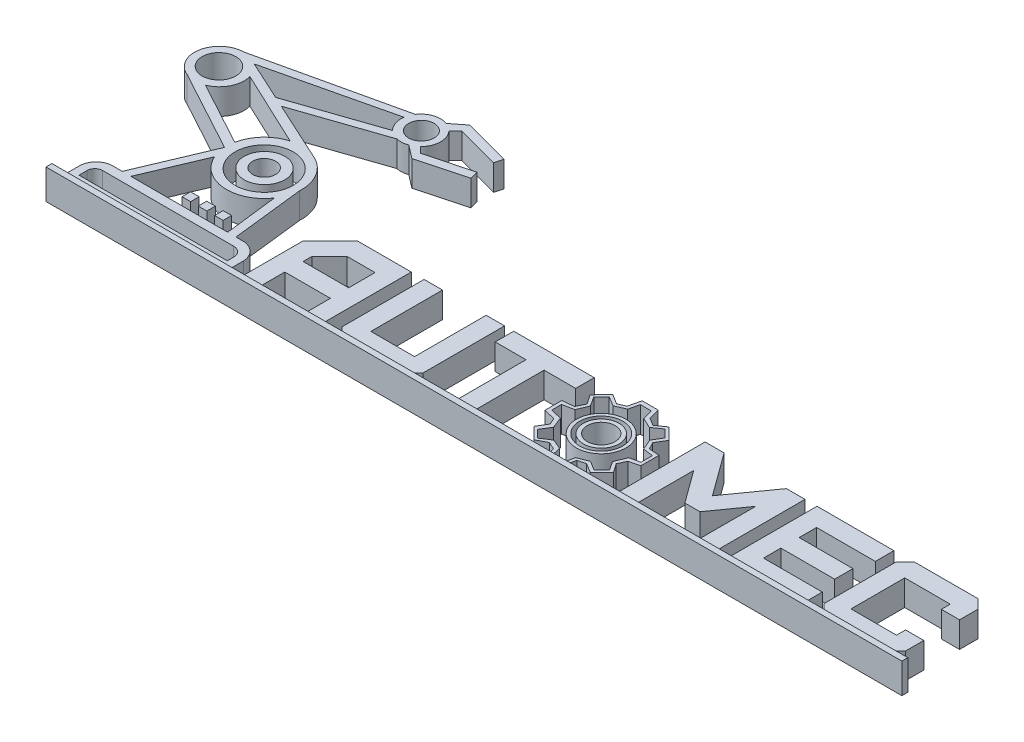
from build123d import *

# Parameters (mm, degrees)
SKETCH1_W              = 10.037720294
SKETCH1_H              = 9.89427134
BOSS_EXTRUDE3_DEPTH    = 30
SKETCH1_W_2            = 9.837608832
BOSS_EXTRUDE3_2_DEPTH  = 30
SKETCH1_W_3            = 10.004172051
BOSS_EXTRUDE3_3_DEPTH  = 30
SKETCH1_R              = 14.841134558
SKETCH1_R_2            = 19.638478863
SKETCH1_R_3            = 33.945181935
BOSS_EXTRUDE3_4_DEPTH  = 30
BOSS_EXTRUDE3_5_DEPTH  = 30
BOSS_EXTRUDE3_6_DEPTH  = 30
BOSS_EXTRUDE3_7_DEPTH  = 30
BOSS_EXTRUDE3_8_DEPTH  = 30
BOSS_EXTRUDE3_9_DEPTH  = 30
BOSS_EXTRUDE3_10_DEPTH = 30
BOSS_EXTRUDE3_11_DEPTH = 30
SKETCH1_R_4            = 23.705875318
SKETCH1_R_5            = 13.441561648
BOSS_EXTRUDE3_12_DEPTH = 30
SKETCH1_R_6            = 28.936539224
SKETCH1_R_7            = 25.172875838
BOSS_EXTRUDE3_13_DEPTH = 30
SKETCH1_R_8            = 20.860639354
SKETCH1_R_9            = 16.254652286
BOSS_EXTRUDE3_14_DEPTH = 30
BOSS_EXTRUDE4_DEPTH    = 35


with BuildPart() as part:
    # Sketch1 → Boss-Extrude3 (new body)
    with BuildSketch(Plane(origin=(0, 0, 0), x_dir=(1, 0, 0), z_dir=(0, 1, 0))):
        with Locations((114.128971817, 54.083331286)):
            Rectangle(SKETCH1_W, SKETCH1_H)
    extrude(amount=BOSS_EXTRUDE3_DEPTH)


with BuildPart() as body_2:
    # Sketch1 → Boss-Extrude3 2 (new body)
    with BuildSketch(Plane(origin=(0, 0, 0), x_dir=(1, 0, 0), z_dir=(0, 1, 0))):
        with Locations((133.169168206, 54.083331286)):
            Rectangle(SKETCH1_W_2, SKETCH1_H)
    extrude(amount=BOSS_EXTRUDE3_2_DEPTH)


with BuildPart() as body_3:
    # Sketch1 → Boss-Extrude3 3 (new body)
    with BuildSketch(Plane(origin=(0, 0, 0), x_dir=(1, 0, 0), z_dir=(0, 1, 0))):
        with Locations((95.198962506, 54.083331286)):
            Rectangle(SKETCH1_W_3, SKETCH1_H)
    extrude(amount=BOSS_EXTRUDE3_3_DEPTH)


with BuildPart() as body_4:
    # Sketch1 → Boss-Extrude3 4 (new body)
    with BuildSketch(Plane(origin=(0, 0, 0), x_dir=(1, 0, 0), z_dir=(0, 1, 0))):
        with BuildLine():
            Line((143.142771274, 268.551222923), (-20.066683919, 231.448561929))
            ThreePointArc((-20.066683919, 231.448561929), (-48.08274217, 207.697002969), (-30.2767921, 175.572491843))
            Line((-30.2767921, 175.572491843), (65.13223045, 123.762206868))
            Line((65.13223045, 123.762206868), (29.665610075, 39.838888731))
            Line((29.665610075, 39.838888731), (17.427719175, 39.838888731))
            ThreePointArc((17.427719175, 39.838888731), (4.37706487, 33.661602398), (-0.92807644, 20.232755838))
            Line((-0.92807644, 20.232755838), (-0.92807644, 6.699341433))
            ThreePointArc((-0.92807644, 6.699341433), (1.439006355, 3.093293076), (5.519838836, 1.695626459))
            Line((5.519838836, 1.695626459), (187.056420311, 1.695626459))
            ThreePointArc((187.056420311, 1.695626459), (189.890342969, 3.516284124), (190.99218603, 6.699341433))
            Line((190.99218603, 6.699341433), (190.99218603, 20.232755838))
            ThreePointArc((190.99218603, 20.232755838), (184.584997904, 34.156147144), (170.350556109, 39.838888731))
            Line((170.350556109, 39.838888731), (162.419916837, 39.838888731))
            Line((162.419916837, 39.838888731), (152.794511162, 123.762206868))
            ThreePointArc((152.794511162, 123.762206868), (145.984902768, 149.800684723), (125.259763461, 166.97163974))
            Line((125.259763461, 166.97163974), (56.575915473, 198.553079106))
            Line((56.575915473, 198.553079106), (157.148813199, 232.909520835))
            ThreePointArc((157.148813199, 232.909520835), (163.806970263, 232.345523476), (170.350556109, 233.698532264))
            Line((170.350556109, 233.698532264), (185.669513374, 221.850702315))
            Line((185.669513374, 221.850702315), (240.175788961, 236.31824449))
            Line((240.175788961, 236.31824449), (237.60073395, 246.019730503))
            Line((237.60073395, 246.019730503), (185.669513374, 232.235682413))
            Line((185.669513374, 232.235682413), (178.835688766, 239.089620535))
            ThreePointArc((178.835688766, 239.089620535), (185.666823394, 255.200048889), (179.328917733, 271.510819989))
            Line((179.328917733, 271.510819989), (187.056420311, 278.803304387))
            Line((187.056420311, 278.803304387), (237.60073395, 265.195725475))
            Line((237.60073395, 265.195725475), (240.175788961, 274.76057084))
            Line((240.175788961, 274.76057084), (185.669513374, 289.434792188))
            Line((185.669513374, 289.434792188), (170.350556109, 277.408883435))
            ThreePointArc((170.350556109, 277.408883435), (155.222671622, 277.661249559), (143.142771274, 268.551222923))
        make_face()
        with BuildLine():
            Line((-1.969110638, 225.472598709), (139.423502901, 258.97550346))
            ThreePointArc((139.423502901, 258.97550346), (140.395436733, 248.10615689), (146.219590259, 238.877582463))
            Line((146.219590259, 238.877582463), (44.470389253, 204.119306881))
            Line((44.470389253, 204.119306881), (-1.969110638, 225.472598709))
        make_face(mode=Mode.SUBTRACT)
        with Locations((163.173974101, 255.540121232)):
            Circle(SKETCH1_R, mode=Mode.SUBTRACT)
        with Locations((-20.066683919, 202.485175867)):
            Circle(SKETCH1_R_2, mode=Mode.SUBTRACT)
        with BuildLine():
            Line((8.324402462, 210.195837049), (97.055580754, 168.462639817))
            ThreePointArc((97.055580754, 168.462639817), (76.78336776, 156.068842703), (65.938427209, 134.92750663))
            Line((65.938427209, 134.92750663), (-8.909613341, 175.572491843))
            ThreePointArc((-8.909613341, 175.572491843), (6.333753594, 189.585847209), (8.324402462, 210.195837049))
        make_face(mode=Mode.SUBTRACT)
        with Locations((109.737807996, 125.434673325)):
            Circle(SKETCH1_R_3, mode=Mode.SUBTRACT)
        with BuildLine():
            ThreePointArc((68.82897061, 108.421864432), (105.123555566, 82.477977197), (145.3839321, 101.699950647))
            Line((145.3839321, 101.699950647), (152.794511162, 39.838888731))
            Line((152.794511162, 39.838888731), (39.756094219, 39.838888731))
            Line((39.756094219, 39.838888731), (68.82897061, 108.421864432))
        make_face(mode=Mode.SUBTRACT)
        with BuildLine():
            Line((17.34286461, 29.251217986), (170.350556109, 29.251217986))
            ThreePointArc((170.350556109, 29.251217986), (177.471060726, 26.709270346), (181.372066191, 20.232755838))
            Line((181.372066191, 20.232755838), (181.372066191, 10.7136894))
            Line((181.372066191, 10.7136894), (8.324402462, 10.7136894))
            Line((8.324402462, 10.7136894), (8.324402462, 20.232755838))
            ThreePointArc((8.324402462, 20.232755838), (10.96584887, 26.609771579), (17.34286461, 29.251217986))
        make_face(mode=Mode.SUBTRACT)
    extrude(amount=BOSS_EXTRUDE3_4_DEPTH)



with BuildPart() as body_5:
    # Sketch1 → Boss-Extrude3 5 (new body)
    with BuildSketch(Plane(origin=(0, 0, 0), x_dir=(1, 0, 0), z_dir=(0, 1, 0))):
        Polygon((205.524825841, 74.70012702), (205.524825841, 1.695626459), (226.323997377, 1.695626459), (226.323997377, 32.972523229), (279.551984747, 32.972523229), (279.551984747, 1.695626459), (300.127509276, 1.695626459), (300.127509276, 106.776035129), (237.60073395, 106.776035129), align=None)
        Polygon((279.551984747, 54.235830794), (226.323997377, 54.235830794), (226.323997377, 64.730398046), (246.6758749, 85.08227557), (279.551984747, 85.08227557), align=None, mode=Mode.SUBTRACT)
    extrude(amount=BOSS_EXTRUDE3_5_DEPTH)


with BuildPart() as body_6:
    # Sketch1 → Boss-Extrude3 6 (new body)
    with BuildSketch(Plane(origin=(0, 0, 0), x_dir=(1, 0, 0), z_dir=(0, 1, 0))):
        Polygon((886.728702325, 1.695626459), (961.16194012, 1.695626459), (971.701040984, 12.234727322), (971.701040984, 33.464350851), (950.471417455, 33.464350851), (950.471417455, 22.849539087), (897.34351409, 22.849539087), (897.34351409, 85.574103193), (950.471417455, 85.574103193), (950.471417455, 75.191954642), (971.701040984, 75.191954642), (971.701040984, 96.728761888), (961.086229219, 107.343573652), (886.728702325, 107.267862751), (876.189601462, 96.728761888), (876.189601462, 12.234727322), align=None)
    extrude(amount=BOSS_EXTRUDE3_6_DEPTH)


with BuildPart() as body_7:
    # Sketch1 → Boss-Extrude3 7 (new body)
    with BuildSketch(Plane(origin=(0, 0, 0), x_dir=(1, 0, 0), z_dir=(0, 1, 0))):
        Polygon((315.111858662, 10.7136894), (324.129921603, 1.695626459), (398.979485821, 1.695626459), (409.026759062, 11.7428997), (409.026759062, 106.776035129), (387.573488527, 106.776035129), (387.573488527, 23.148896994), (336.565129197, 23.148896994), (336.565129197, 106.776035129), (315.111858662, 106.776035129), align=None)
    extrude(amount=BOSS_EXTRUDE3_7_DEPTH)


with BuildPart() as body_8:
    # Sketch1 → Boss-Extrude3 8 (new body)
    with BuildSketch(Plane(origin=(0, 0, 0), x_dir=(1, 0, 0), z_dir=(0, 1, 0))):
        Polygon((773.755843894, 1.695626459), (863.525068241, 1.695626459), (863.525068241, 23.148896994), (794.917323579, 23.148896994), (794.917323579, 43.388951015), (857.73350538, 43.388951015), (857.73350538, 64.730398046), (794.917323579, 64.730398046), (794.917323579, 85.08227557), (863.525068241, 85.08227557), (863.525068241, 106.776035129), (773.755843894, 106.776035129), align=None)
    extrude(amount=BOSS_EXTRUDE3_8_DEPTH)


with BuildPart() as body_9:
    # Sketch1 → Boss-Extrude3 9 (new body)
    with BuildSketch(Plane(origin=(0, 0, 0), x_dir=(1, 0, 0), z_dir=(0, 1, 0))):
        Polygon((455.785825283, 85.08227557), (455.785825283, 1.695626459), (476.808643824, 1.695626459), (476.808643824, 85.08227557), (513.710399774, 85.08227557), (513.710399774, 106.776035129), (419.778657356, 106.776035129), (419.778657356, 85.08227557), align=None)
    extrude(amount=BOSS_EXTRUDE3_9_DEPTH)


with BuildPart() as body_10:
    # Sketch1 → Boss-Extrude3 10 (new body)
    with BuildSketch(Plane(origin=(0, 0, 0), x_dir=(1, 0, 0), z_dir=(0, 1, 0))):
        Polygon((738.028346548, 1.695626459), (759.722106106, 1.695626459), (759.722106106, 106.776035128), (738.028346548, 106.776035128), (702.133002124, 56.344559491), (665.566716683, 106.475757274), (643.425663113, 106.475757274), (643.425663113, 1.695626459), (665.566716683, 1.695626459), (665.566716683, 70.992514208), (693.298945397, 32.972523229), (710.967058851, 32.972523229), (738.028346548, 70.992514208), align=None)
    extrude(amount=BOSS_EXTRUDE3_10_DEPTH)


with BuildPart() as body_11:
    # Sketch1 → Boss-Extrude3 11 (new body)
    with BuildSketch(Plane(origin=(0, 0, 0), x_dir=(1, 0, 0), z_dir=(0, 1, 0))):
        Polygon((561.811156285, 11.022132391), (564.206833782, 1.695626459), (584.548916634, 1.695626459), (587.139669167, 13.048376699), (596.077110393, 15.344116066), (607.08101677, 8.714733796), (620.584288241, 22.351755897), (613.542887133, 32.620988551), (617.886588615, 41.869512454), (629.982213547, 44.976486993), (629.982213547, 66.07345155), (617.886588615, 66.967470506), (613.542887133, 75.129982665), (620.710099352, 87.026616321), (607.08101677, 100.448493701), (596.077110393, 92.903341968), (587.139669167, 98.287767497), (583.786023452, 111.343697056), (565.065547238, 111.343697056), (561.811156285, 97.082864651), (553.182677099, 93.315612167), (541.853221859, 100.448493701), (528.56298499, 87.026616321), (536.144263058, 75.970023025), (531.496196769, 66.07345155), (517.881347226, 64.708779488), (517.881347226, 44.976486993), (531.496196769, 41.869512454), (534.830790982, 34.231989649), (527.62577602, 22.272608391), (541.287700266, 8.744679012), (553.182677099, 15.074621006), align=None)
        Polygon((540.060260784, 75.991641583), (532.888416484, 87.04823488), (541.853221859, 96.101837134), (553.182677099, 89.276325618), (565.065547238, 94.464467245), (567.806581737, 106.475757274), (580.70071182, 106.475757274), (583.786023452, 94.464467245), (596.077110393, 88.691782532), (607.08101677, 96.236934265), (615.924941998, 87.04823488), (609.263818115, 75.991641583), (614.808785716, 63.291500634), (626.508975948, 61.946779828), (626.508975948, 48.502177727), (614.808785716, 46.108956998), (609.263818115, 32.642607109), (615.924941998, 22.373374455), (607.08101677, 13.224486288), (596.077110393, 19.989186093), (583.764503353, 15.08767265), (581.488576126, 5.202505812), (567.089265505, 5.202505812), (565.065547238, 15.096239565), (553.182677099, 19.989186093), (541.853221859, 12.640350262), (532.888416484, 21.306328792), (540.060260784, 32.972523229), (534.830790982, 46.108956998), (521.682409764, 49.136195616), (521.682409764, 60.602059022), (534.830790982, 63.291500634), align=None, mode=Mode.SUBTRACT)
    extrude(amount=BOSS_EXTRUDE3_11_DEPTH)


with BuildPart() as body_12:
    # Sketch1 → Boss-Extrude3 12 (new body)
    with BuildSketch(Plane(origin=(0, 0, 0), x_dir=(1, 0, 0), z_dir=(0, 1, 0))):
        with Locations((109.350589401, 126.209110515)):
            Circle(SKETCH1_R_4)
        with Locations((108.963370806, 126.209110515)):
            Circle(SKETCH1_R_5, mode=Mode.SUBTRACT)
    extrude(amount=BOSS_EXTRUDE3_12_DEPTH)


with BuildPart() as body_13:
    # Sketch1 → Boss-Extrude3 13 (new body)
    with BuildSketch(Plane(origin=(0, 0, 0), x_dir=(1, 0, 0), z_dir=(0, 1, 0))):
        with Locations((574.321184091, 54.290961869)):
            Circle(SKETCH1_R_6)
        with Locations((574.321184091, 54.290961869)):
            Circle(SKETCH1_R_7, mode=Mode.SUBTRACT)
    extrude(amount=BOSS_EXTRUDE3_13_DEPTH)


with BuildPart() as body_14:
    # Sketch1 → Boss-Extrude3 14 (new body)
    with BuildSketch(Plane(origin=(0, 0, 0), x_dir=(1, 0, 0), z_dir=(0, 1, 0))):
        with Locations((574.321184091, 54.290961869)):
            Circle(SKETCH1_R_8)
        with Locations((574.321184091, 54.290961869)):
            Circle(SKETCH1_R_9, mode=Mode.SUBTRACT)
    extrude(amount=BOSS_EXTRUDE3_14_DEPTH)


with BuildPart() as body_4_1:
    add(body_4.part)

    add(body_5.part)  # Boss-Extrude4 merges body 5

    add(body_6.part)  # Boss-Extrude4 merges body 6

    add(body_7.part)  # Boss-Extrude4 merges body 7

    add(body_8.part)  # Boss-Extrude4 merges body 8

    add(body_9.part)  # Boss-Extrude4 merges body 9

    add(body_10.part)  # Boss-Extrude4 merges body 10

    add(body_11.part)  # Boss-Extrude4 merges body 11
    # Sketch1<9> → Boss-Extrude4 (add)
    with BuildSketch(Plane(origin=(0, 0, 0), x_dir=(1, 0, 0), z_dir=(0, 1, 0))):
        Polygon((187.056420311, 1.695626459), (5.519838836, 1.695626459), (-14.265268254, 1.695626459), (-14.265268254, -5.210883228), (984.802454964, -5.210883228), (984.802454964, 1.695626459), (961.16194012, 1.695626459), (886.728702325, 1.695626459), (863.525068241, 1.695626459), (773.755843894, 1.695626459), (759.722106106, 1.695626459), (738.028346548, 1.695626459), (665.566716683, 1.695626459), (643.425663113, 1.695626459), (584.548916634, 1.695626459), (564.206833782, 1.695626459), (476.808643824, 1.695626459), (455.785825283, 1.695626459), (398.979485821, 1.695626459), (324.129921603, 1.695626459), (300.127509276, 1.695626459), (279.551984747, 1.695626459), (226.323997377, 1.695626459), (205.524825841, 1.695626459), align=None)
    extrude(amount=BOSS_EXTRUDE4_DEPTH)


solid = Compound([part.part, body_2.part, body_3.part, body_12.part, body_13.part, body_14.part, body_4_1.part])
